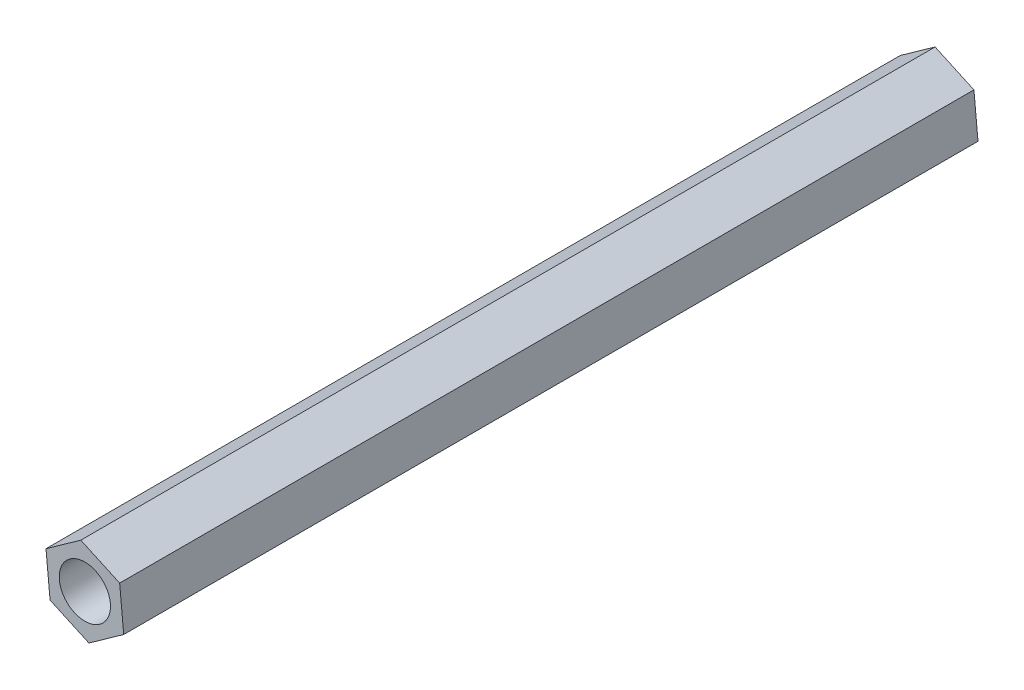
from build123d import *

# Parameters (mm, degrees)
SKETCH1_R           = 1.5
BOSS_EXTRUDE1_DEPTH = 50


with BuildPart() as part:
    # Sketch1 → Boss-Extrude1 (new body)
    with BuildSketch(Plane.XY):
        Polygon((2.036416368, 1.450175292), (-0.237680459, 2.488675953), (-2.274096827, 1.038500661), (-2.036416368, -1.450175292), (0.237680459, -2.488675953), (2.274096827, -1.038500661), align=None)
        Circle(SKETCH1_R, mode=Mode.SUBTRACT)
    extrude(amount=BOSS_EXTRUDE1_DEPTH)


solid = part.part
